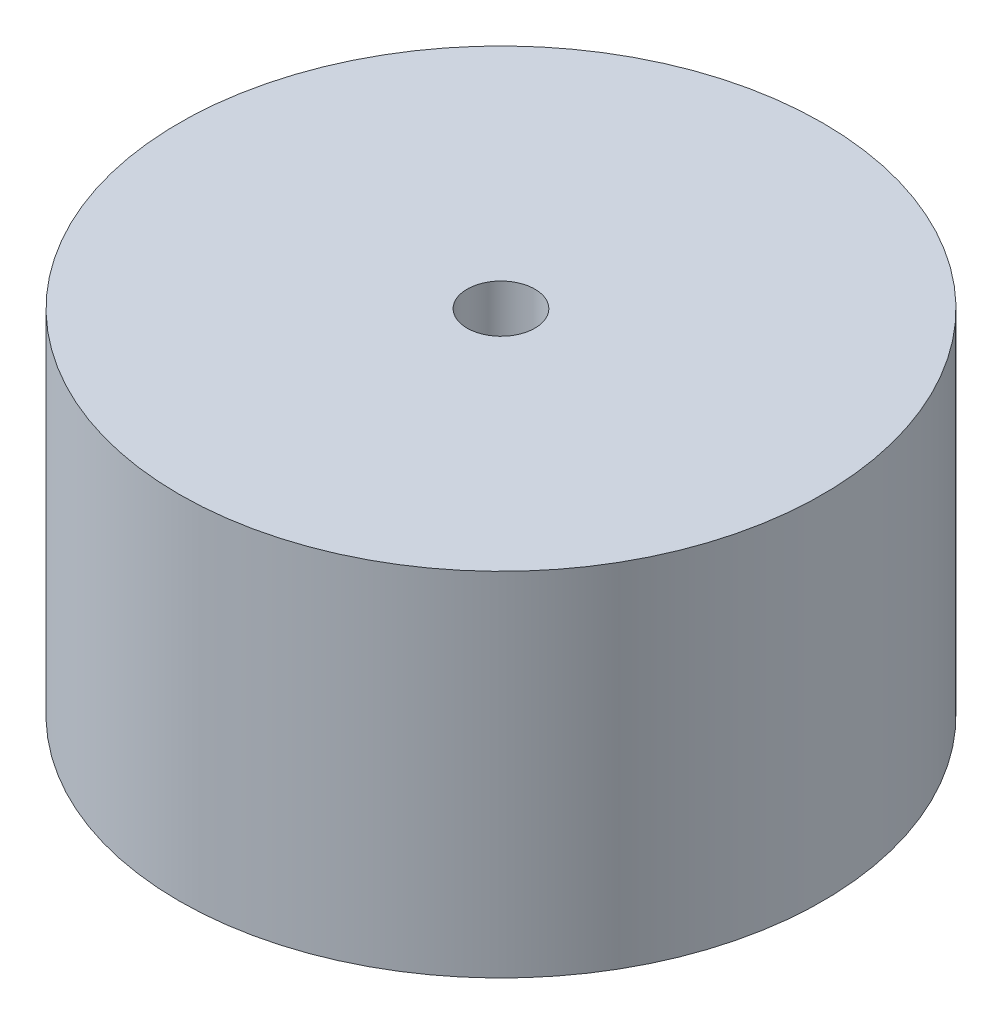
from build123d import *

# Parameters (mm, degrees)
CROQUIS1_R              = 15
SALIENTE_EXTRUIR1_DEPTH = 4
CROQUIS2_R              = 23.75
SALIENTE_EXTRUIR2_DEPTH = 26
CROQUIS3_R              = 2.5
CORTAR_EXTRUIR1_DEPTH   = 40
CORTAR_EXTRUIR3_START   = -3
CROQUIS4_R              = 20.840702769
CROQUIS4_R_2            = 9.281745818
CORTAR_EXTRUIR3_DEPTH   = 19


with BuildPart() as part:
    # Croquis1 → Saliente-Extruir1 (new body)
    with BuildSketch(Plane(origin=(0, 0, 0), x_dir=(1, 0, 0), z_dir=(0, 1, 0))):
        with Locations(Location((0, 0, 0), (0, 0, 270))):
            Circle(CROQUIS1_R)
    extrude(amount=SALIENTE_EXTRUIR1_DEPTH)

    # Croquis2 → Saliente-Extruir2 (add)
    with BuildSketch(Plane(origin=(0, 4, 0), x_dir=(1, 0, 0), z_dir=(0, 1, 0))):
        with Locations(Location((0, 0, 0), (0, 0, 90))):
            Circle(CROQUIS2_R)
    extrude(amount=SALIENTE_EXTRUIR2_DEPTH)

    # Croquis3 → Cortar-Extruir1 (cut)
    with BuildSketch(Plane(origin=(0, 30, 0), x_dir=(1, 0, 0), z_dir=(0, 1, 0))):
        with Locations(Location((0, 0, 0), (0, 0, 270))):
            Circle(CROQUIS3_R)
    extrude(amount=-CORTAR_EXTRUIR1_DEPTH, mode=Mode.SUBTRACT)

    # Croquis4 → Cortar-Extruir3 (cut)
    with BuildSketch(Plane(origin=(0, 30, 0), x_dir=(1, 0, 0), z_dir=(0, 1, 0)).offset(CORTAR_EXTRUIR3_START)):
        with Locations(Location((0, 0, 0), (0, 0, 270))):
            Circle(CROQUIS4_R)
        with Locations(Location((0, 0, 0), (0, 0, 270))):
            Circle(CROQUIS4_R_2, mode=Mode.SUBTRACT)
    extrude(amount=-CORTAR_EXTRUIR3_DEPTH, mode=Mode.SUBTRACT)


solid = part.part
